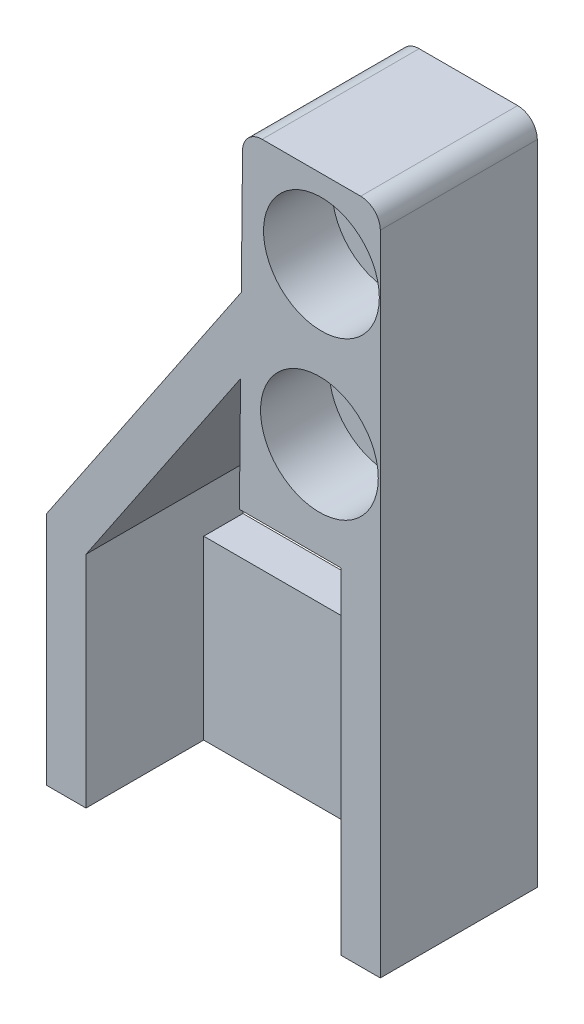
from build123d import *

# Parameters (mm, degrees)
SKETCH_1_R          = 1.6
EXTRUDE_1_DEPTH     = 8
SKETCH_2_W          = 13
SKETCH_2_H          = 17.095287854
CUT_EXTRUDE_1_DEPTH = 6
EXTRUDE_2_DEPTH     = 8
SKETCH_4_R          = 3
SKETCH_4_R_2        = 2.95
CUT_EXTRUDE_2_DEPTH = 3.5
FILLET_1_R          = 1


with BuildPart() as part:
    # 草图1 → 凸台-拉伸1 (new body)
    with BuildSketch(Plane.XY):
        Polygon((0, 0), (6, 0), (6, 24), (6, 34.003436918), (0, 34.003436918), (-1.010556426, 34.003436918), (-1.260244026, 9), (-11, 9), (-11, 0), align=None)
        with Locations((2.89726379, 22)):
            Circle(SKETCH_1_R, mode=Mode.SUBTRACT)
        with Locations((3, 30)):
            Circle(SKETCH_1_R, mode=Mode.SUBTRACT)
    extrude(amount=EXTRUDE_1_DEPTH)

    # 草图2 → 切除-拉伸1 (cut)
    with BuildSketch(Plane.XY.offset(8)):
        with Locations((-2.498171462, 8.547643927)):
            Rectangle(SKETCH_2_W, SKETCH_2_H)
    extrude(amount=-CUT_EXTRUDE_1_DEPTH, mode=Mode.SUBTRACT)

    # 草图3 → 凸台-拉伸2 (add)
    with BuildSketch(Plane.XY.offset(8)):
        Polygon((-11, 12), (-1.083308234, 26.718152327), (-1.121520842, 22.891584471), (-8.998171462, 11.201219742), (-8.998171462, 9), (-11, 9), align=None)
    extrude(amount=-EXTRUDE_2_DEPTH)

    # 草图4 → 切除-拉伸2 (cut)
    with BuildSketch(Plane.XY.offset(8)):
        with Locations((2.89726379, 22)):
            Circle(SKETCH_4_R)
        with Locations((3, 30)):
            Circle(SKETCH_4_R_2)
    extrude(amount=-CUT_EXTRUDE_2_DEPTH, mode=Mode.SUBTRACT)

    # 圆角1
    fillet_1_edges = [part.edges().sort_by_distance(p)[0] for p in [
        (-1.010556426, 34.003436918, 4),
        (6, 34.003436918, 4),
    ]]
    fillet(fillet_1_edges, radius=FILLET_1_R)


solid = part.part
